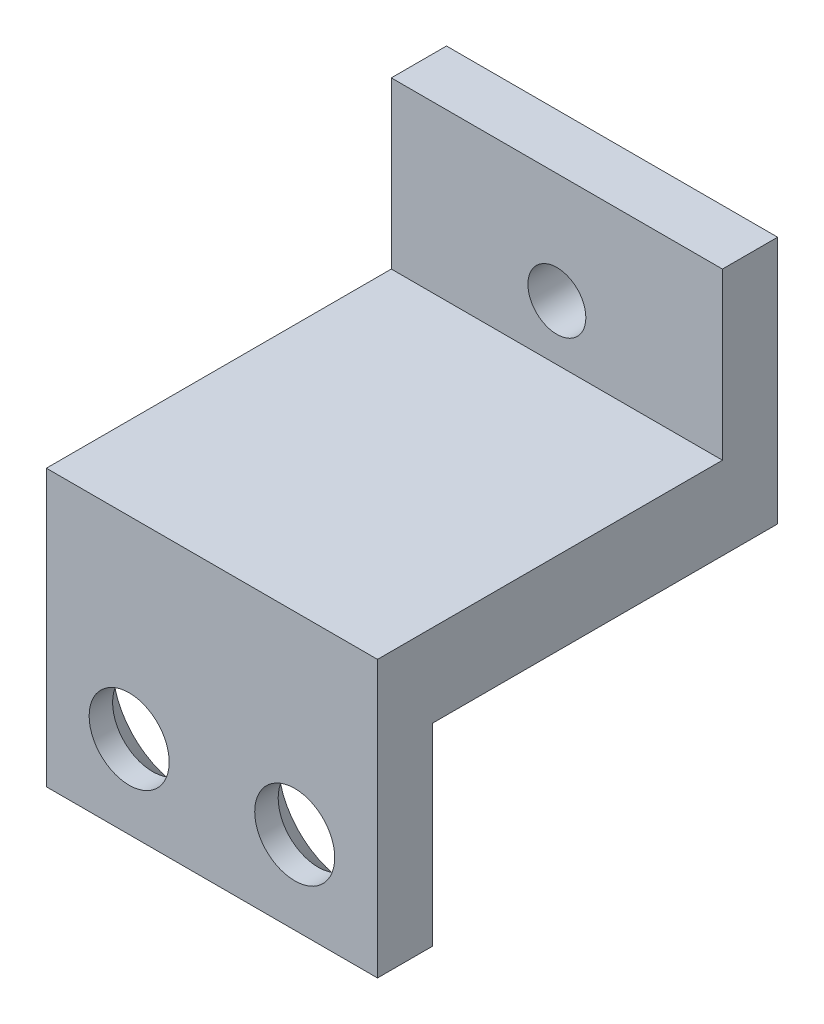
from build123d import *

# Parameters (mm, degrees)
LINK_EYE_SHELF_START          = -14.5
SKETCH1_W                     = 12
SKETCH1_H                     = 9
SKETCH1_R                     = 1.05
LINK_EYE_SHELF_DEPTH          = 2
OUTBOARD_WEB_START            = -13.5
SKETCH2_W                     = 12
SKETCH2_H                     = 3
OUTBOARD_WEB_DEPTH            = 12.5
INTERMEDIATE_PLATE_FOOT_START = -2
SKETCH3_W                     = 12
SKETCH3_H                     = 10
SKETCH3_R                     = 1.45
INTERMEDIATE_PLATE_FOOT_DEPTH = 2
CHAMFER1_SIZE                 = 1.15


with BuildPart() as part:
    # Sketch1 → Link_Eye_Shelf (new body)
    with BuildSketch(Plane.XY.offset(LINK_EYE_SHELF_START)):
        with Locations((-20, 35.5)):
            Rectangle(SKETCH1_W, SKETCH1_H)
        with Locations((-20, 36)):
            Circle(SKETCH1_R, mode=Mode.SUBTRACT)
    extrude(amount=LINK_EYE_SHELF_DEPTH)

    # Sketch2 → Outboard_Web (add)
    with BuildSketch(Plane.XY.offset(OUTBOARD_WEB_START)):
        with Locations((-20, 32.5)):
            Rectangle(SKETCH2_W, SKETCH2_H)
    extrude(amount=OUTBOARD_WEB_DEPTH)

    # Sketch3 → Intermediate_Plate_Foot (add)
    with BuildSketch(Plane.XY.offset(INTERMEDIATE_PLATE_FOOT_START)):
        with Locations((-20, 29)):
            Rectangle(SKETCH3_W, SKETCH3_H)
        with Locations((-23, 27)):
            Circle(SKETCH3_R, mode=Mode.SUBTRACT)
        with Locations((-17, 27)):
            Circle(SKETCH3_R, mode=Mode.SUBTRACT)
    extrude(amount=INTERMEDIATE_PLATE_FOOT_DEPTH)

    # Chamfer1
    chamfer1_edges = [part.edges().sort_by_distance(p)[0] for p in [
        (-18.45, 27, -2),
        (-24.45, 27, -2),
    ]]
    chamfer(chamfer1_edges, length=CHAMFER1_SIZE)


solid = part.part
